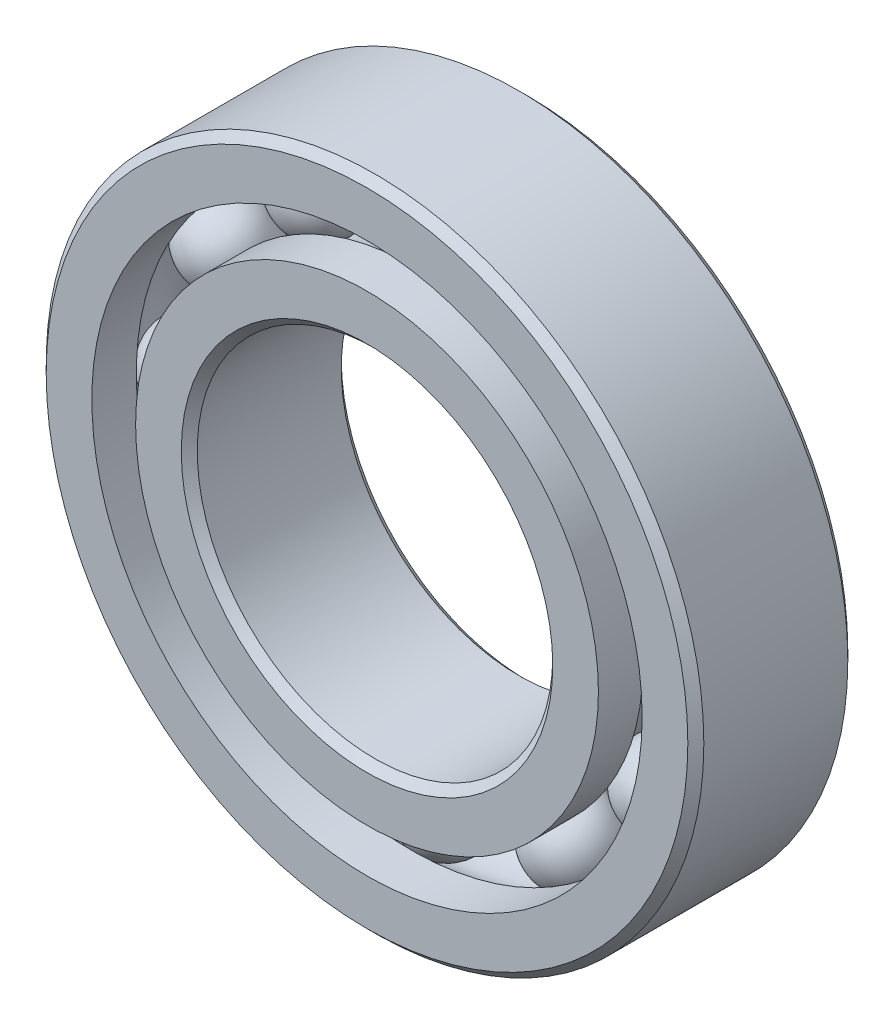
from build123d import *

# Parameters (mm, degrees)
CIRPATTERN1_COUNT = 12


with BuildPart() as part:
    # Sketch1 → Revolve1 (revolve)
    with BuildSketch(Plane(origin=(0, 0, 0), x_dir=(0, 0, -1), z_dir=(1, 0, 0))):
        with BuildLine():
            Line((4.05, 18.5), (-4.05, 18.5))
            Line((-4.05, 18.5), (-4.5, 18.05))
            Line((-4.5, 18.05), (-4.5, 15.480769231))
            Line((-4.5, 15.480769231), (-2, 15.480769231))
            ThreePointArc((-2, 15.480769231), (0, 16.598359619), (2, 15.480769231))
            Line((2, 15.480769231), (4.5, 15.480769231))
            Line((4.5, 15.480769231), (4.5, 18.05))
            Line((4.5, 18.05), (4.05, 18.5))
        make_face()
    revolve(axis=Axis((0, 0, 4.5), (0, 0, -1)))


with BuildPart() as body_2:
    # Sketch3 → Revolve3 (revolve)
    with BuildSketch(Plane(origin=(0, 0, 0), x_dir=(0, 0, -1), z_dir=(1, 0, 0))):
        with BuildLine():
            Line((-4.5, 13.019230769), (-2, 13.019230769))
            ThreePointArc((-2, 13.019230769), (0, 11.901640381), (2, 13.019230769))
            Line((2, 13.019230769), (4.5, 13.019230769))
            Line((4.5, 13.019230769), (4.5, 10.45))
            Line((4.5, 10.45), (4.05, 10))
            Line((4.05, 10), (-4.05, 10))
            Line((-4.05, 10), (-4.5, 10.45))
            Line((-4.5, 10.45), (-4.5, 13.019230769))
        make_face()
    revolve(axis=Axis((0, 0, 4.5), (0, 0, -1)))


with BuildPart() as body_3:
    # Sketch4 → Revolve4 (revolve)
    with BuildSketch(Plane(origin=(0, 0, 0), x_dir=(0, 0, -1), z_dir=(1, 0, 0))):
        with BuildLine():
            Line((-2.348359619, 14.25), (2.348359619, 14.25))
            ThreePointArc((2.348359619, 14.25), (0, 16.598359619), (-2.348359619, 14.25))
        make_face()
    revolve(axis=Axis((0, 14.25, 2.348359619), (0, 0, -1)))


with BuildPart() as cirpattern1_1:
    # CirPattern1: pattern copy
    add(body_3.part.rotate(Axis((0, 0, -4.5), (0, 0, 1)), 1 * 360 / CIRPATTERN1_COUNT))


with BuildPart() as cirpattern1_2:
    # CirPattern1: pattern copy
    add(body_3.part.rotate(Axis((0, 0, -4.5), (0, 0, 1)), 2 * 360 / CIRPATTERN1_COUNT))


with BuildPart() as cirpattern1_3:
    # CirPattern1: pattern copy
    add(body_3.part.rotate(Axis((0, 0, -4.5), (0, 0, 1)), 3 * 360 / CIRPATTERN1_COUNT))


with BuildPart() as cirpattern1_4:
    # CirPattern1: pattern copy
    add(body_3.part.rotate(Axis((0, 0, -4.5), (0, 0, 1)), 4 * 360 / CIRPATTERN1_COUNT))


with BuildPart() as cirpattern1_5:
    # CirPattern1: pattern copy
    add(body_3.part.rotate(Axis((0, 0, -4.5), (0, 0, 1)), 5 * 360 / CIRPATTERN1_COUNT))


with BuildPart() as cirpattern1_6:
    # CirPattern1: pattern copy
    add(body_3.part.rotate(Axis((0, 0, -4.5), (0, 0, 1)), 6 * 360 / CIRPATTERN1_COUNT))


with BuildPart() as cirpattern1_7:
    # CirPattern1: pattern copy
    add(body_3.part.rotate(Axis((0, 0, -4.5), (0, 0, 1)), 7 * 360 / CIRPATTERN1_COUNT))


with BuildPart() as cirpattern1_8:
    # CirPattern1: pattern copy
    add(body_3.part.rotate(Axis((0, 0, -4.5), (0, 0, 1)), 8 * 360 / CIRPATTERN1_COUNT))


with BuildPart() as cirpattern1_9:
    # CirPattern1: pattern copy
    add(body_3.part.rotate(Axis((0, 0, -4.5), (0, 0, 1)), 9 * 360 / CIRPATTERN1_COUNT))


with BuildPart() as cirpattern1_10:
    # CirPattern1: pattern copy
    add(body_3.part.rotate(Axis((0, 0, -4.5), (0, 0, 1)), 10 * 360 / CIRPATTERN1_COUNT))


with BuildPart() as cirpattern1_11:
    # CirPattern1: pattern copy
    add(body_3.part.rotate(Axis((0, 0, -4.5), (0, 0, 1)), 11 * 360 / CIRPATTERN1_COUNT))


solid = Compound([part.part, body_2.part, body_3.part, cirpattern1_1.part, cirpattern1_2.part, cirpattern1_3.part, cirpattern1_4.part, cirpattern1_5.part, cirpattern1_6.part, cirpattern1_7.part, cirpattern1_8.part, cirpattern1_9.part, cirpattern1_10.part, cirpattern1_11.part])
